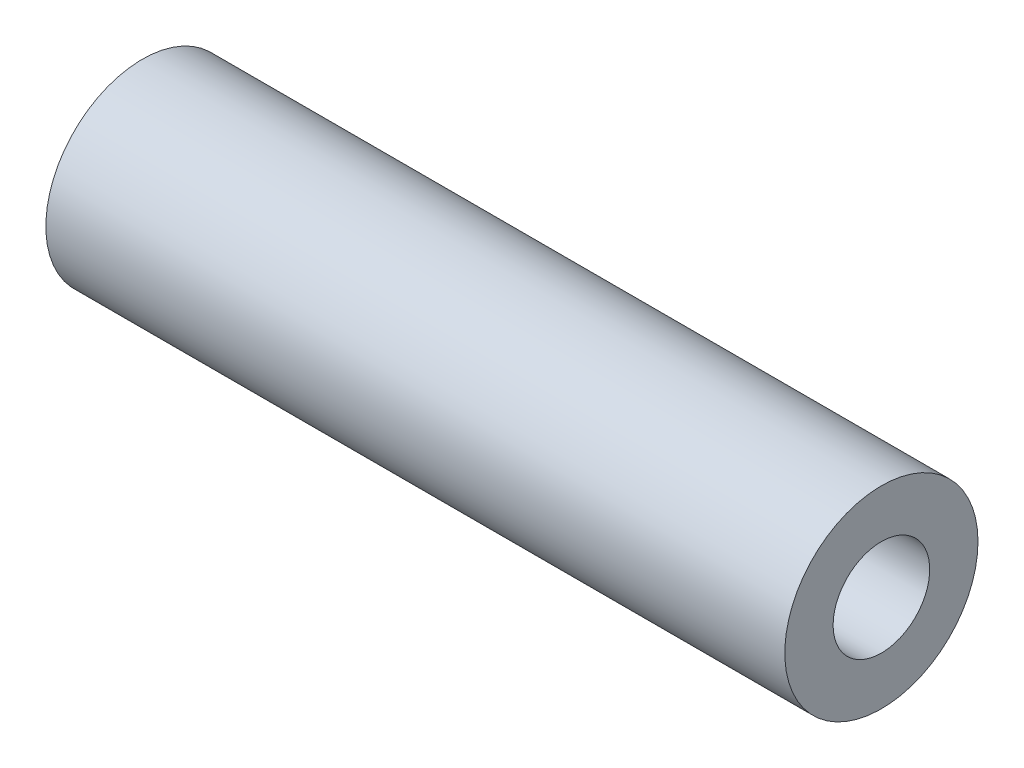
from build123d import *

# Parameters (mm, degrees)
SKETCH_1_R         = 5
EXTRUDE_1_DEPTH    = 38.25
HOLE_WIZARD_M6_1_D = 5


with BuildPart() as part:
    # 草图1 → 凸台-拉伸1 (new body)
    with BuildSketch(Plane(origin=(0, 0, 0), x_dir=(0, 0, -1), z_dir=(1, 0, 0))):
        Circle(SKETCH_1_R)
    extrude(amount=EXTRUDE_1_DEPTH)

    # M6 螺纹孔1 (through all)
    with Locations(Plane.ZY):
        with Locations((0, 0)):
            Hole(HOLE_WIZARD_M6_1_D / 2)


solid = part.part
